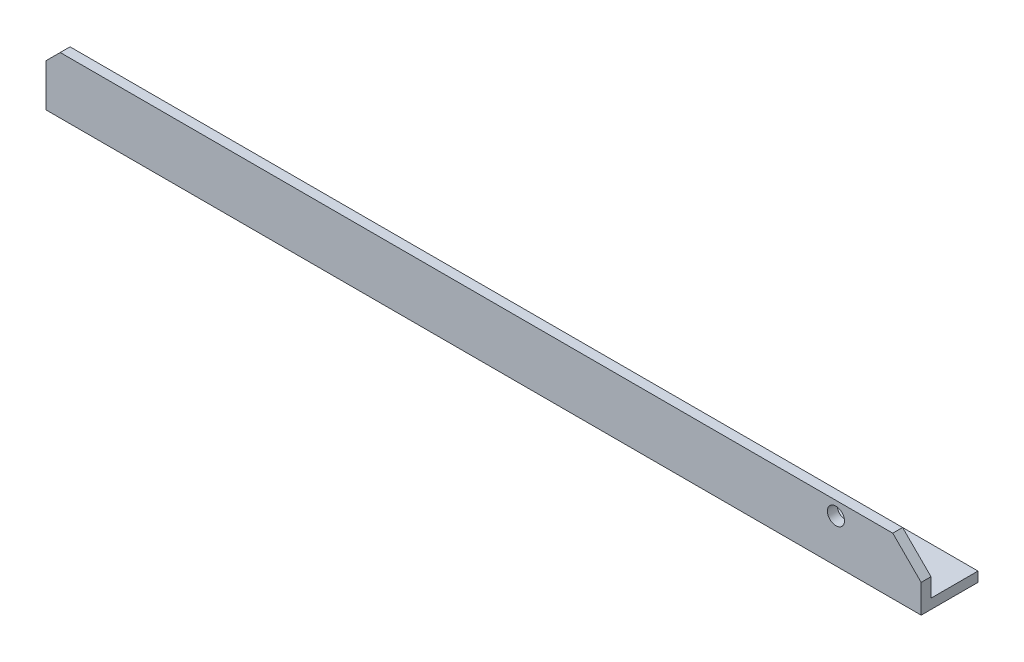
from build123d import *

# Parameters (mm, degrees)
BOSS_EXTRUDE1_DEPTH = 308
SKETCH2_R           = 3
CUT_EXTRUDE1_DEPTH  = 310.295974756


with BuildPart() as part:
    # Sketch1 → Boss-Extrude1 (new body)
    with BuildSketch(Plane(origin=(0, 0, 0), x_dir=(0, 0, -1), z_dir=(1, 0, 0))):
        Polygon((0, 0), (20, 0), (20, 3.461178467), (3.461178467, 3.461178467), (3.461178467, 20), (0, 20), align=None)
    extrude(amount=BOSS_EXTRUDE1_DEPTH)

    # Sketch2 → Cut-Extrude1 (cut, through all)
    with BuildSketch(Plane.XY):
        with Locations((278, 15.25)):
            Circle(SKETCH2_R)
        Polygon((308, 10), (298, 20), (308, 20), align=None)
        Polygon((5, 20), (0, 20), (0, 15), align=None)
    extrude(amount=-CUT_EXTRUDE1_DEPTH, mode=Mode.SUBTRACT)


solid = part.part
